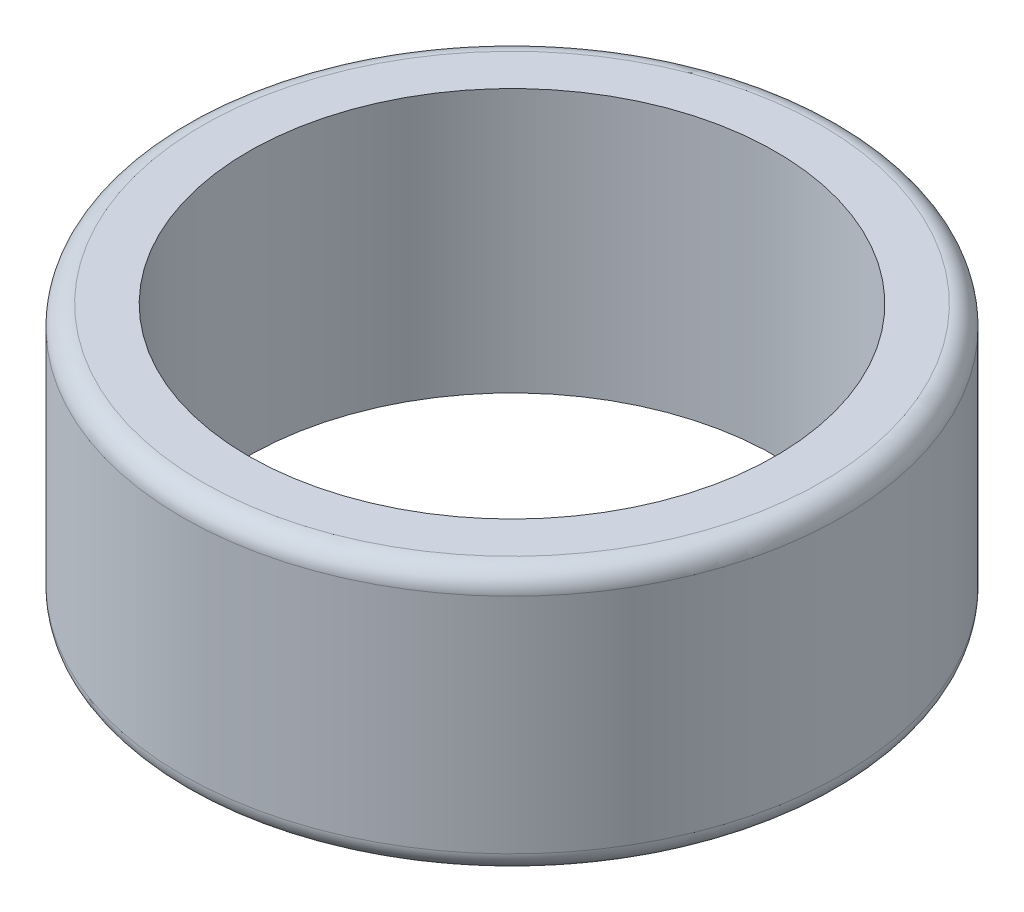
from build123d import *

# Parameters (mm, degrees)
SKETCH_1_R          = 32.5
EXTRUDE_1_DEPTH     = 26
SKETCH_3_R          = 26
CUT_EXTRUDE_1_DEPTH = 53.80624963
FILLET_1_R          = 2


with BuildPart() as part:
    # 草图1 → 凸台-拉伸1 (new body)
    with BuildSketch(Plane(origin=(0, 0, 0), x_dir=(1, 0, 0), z_dir=(0, 1, 0))):
        with Locations(Location((0, 0, 0), (0, 0, 90))):
            Circle(SKETCH_1_R)
    extrude(amount=EXTRUDE_1_DEPTH)

    # 草图3 → 切除-拉伸1 (cut, through all)
    with BuildSketch(Plane(origin=(0, 26, 0), x_dir=(1, 0, 0), z_dir=(0, 1, 0))):
        with Locations(Location((0, 0, 0), (0, 0, 270))):
            Circle(SKETCH_3_R)
    extrude(amount=-CUT_EXTRUDE_1_DEPTH, mode=Mode.SUBTRACT)

    # 圆角1
    fillet_1_edges = [part.edges().sort_by_distance(p)[0] for p in [
        (0, 0, 32.5),
        (0, 26, 32.5),
    ]]
    fillet(fillet_1_edges, radius=FILLET_1_R)


solid = part.part
